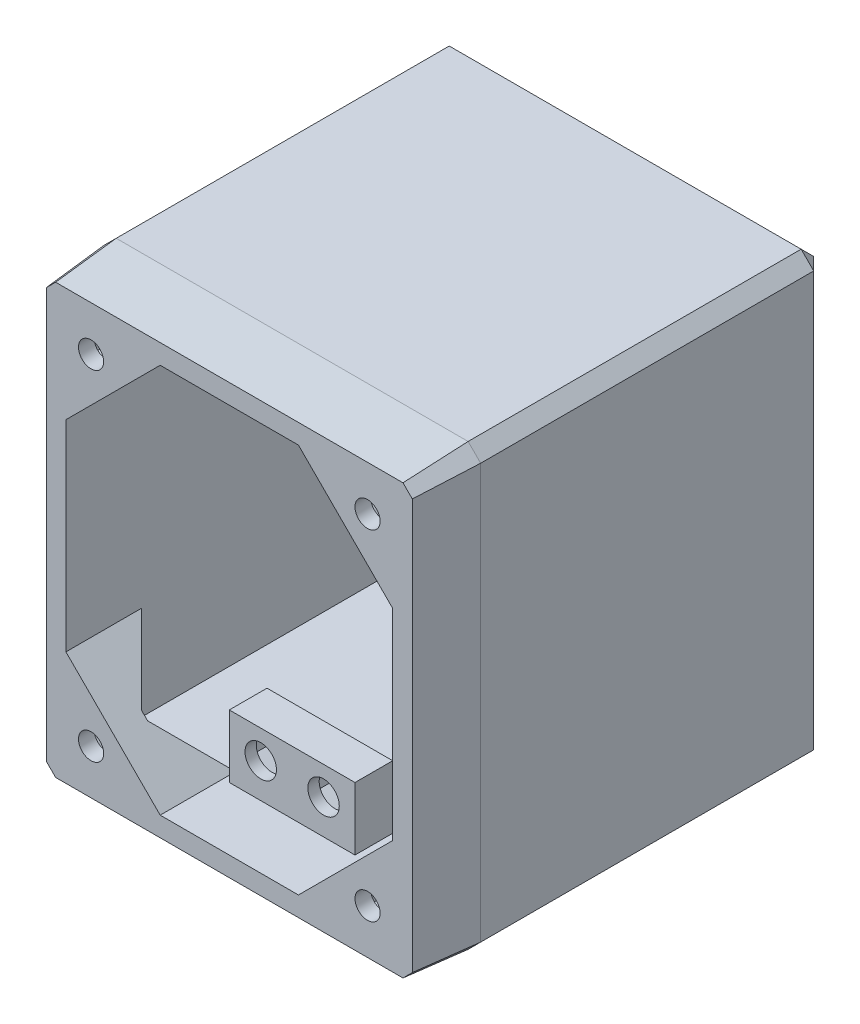
from build123d import *
from OCP.BRepFilletAPI import BRepFilletAPI_MakeChamfer

# Parameters (mm, degrees)
SKIZZE1_W                          = 60
SKIZZE1_H                          = 70
GRUNDK_RPER_DEPTH                  = 65
FASE2_SIZE                         = 2
WANDUNG1_T                         = -4
SKIZZE2_W                          = 20
SKIZZE2_H                          = 6
AUFSATZ_LINEAR_AUSTRAGEN1_DEPTH    = 10
BOHRUNGEN_SERVO_REACH              = 109.355
SKIZZE3_R                          = 2.5
SECHSKANT_START                    = -4.2
SKIZZE5_R                          = 2.5
SKIZZE5_R_2                        = 2
SECHSKANT_DEPTH                    = 4.2
AUSPARUNGEN_DEPTH                  = 5
FASE3_SIZE                         = 7
BOHRUNGENHALTERUNG_REACH           = 114.805
SKIZZE8_R                          = 2
SECHSKANT_START_2                  = -9.5
SECHSKANT_DECKEL_DEPTH             = 9.5
BOHRUNG_VERSCHRAUBUNG_DECKEL_REACH = 114.805
SKIZZE11_R                         = 3
SKIZZE14_R                         = 0.883929471
SKIZZE14_W                         = 12
SKIZZE14_H                         = 10
VERTIEFUNG_DECKEL_DEPTH            = 2
SKIZZE16_R                         = 6.25
AUFSATZ_KABELBOHRUNGEN_DEPTH       = 4
BOHRUNGSDURCHMESSER_KABEL_REACH    = 117.33
SKIZZE17_R                         = 4.5
FASE4_SIZE                         = 10
FASE4_SIZE2                        = 0.874886635


with BuildPart() as part:
    # Skizze1 → Grundkörper (new body)
    with BuildSketch(Plane.XY):
        with Locations((30, 35)):
            Rectangle(SKIZZE1_W, SKIZZE1_H)
    extrude(amount=GRUNDK_RPER_DEPTH)

    # Fase2
    fase2_edges = [part.edges().sort_by_distance(p)[0] for p in [
        (30, 70, 0),
        (60, 35, 0),
        (0, 35, 0),
        (0, 70, 32.5),
        (60, 70, 32.5),
        (60, 0, 32.5),
        (0, 0, 32.5),
    ]]
    chamfer(fase2_edges, length=FASE2_SIZE)

    # Wandung1
    wandung1_openings = [part.faces().sort_by_distance(p)[0] for p in [
        (30, 35, 65),
    ]]
    offset(amount=WANDUNG1_T, openings=wandung1_openings)

    # Skizze2 → Aufsatz-Linear austragen1 (add)
    with BuildSketch(Plane(origin=(0, 4, 0), x_dir=(1, 0, 0), z_dir=(0, 1, 0))):
        with Locations((30, -52)):
            Rectangle(SKIZZE2_W, SKIZZE2_H)
    aufsatz_linear_austragen1 = extrude(amount=AUFSATZ_LINEAR_AUSTRAGEN1_DEPTH)

    # Spiegeln1: Aufsatz-Linear austragen1 across plane
    add(aufsatz_linear_austragen1.mirror(Plane(origin=(0, 35, 0), x_dir=(0, 0, 1), z_dir=(0, -1, 0))))

    # Skizze3 → Bohrungen Servo (cut, up to next)
    with BuildSketch(Plane.XY.offset(55), mode=Mode.PRIVATE) as bohrungen_servo_sk1:
        with Locations((25, 9.5)):
            Circle(SKIZZE3_R)
    bohrungen_servo_tool1 = extrude(bohrungen_servo_sk1.sketch, amount=-BOHRUNGEN_SERVO_REACH, mode=Mode.PRIVATE) & part.part
    # Skizze3 → Bohrungen Servo (cut, up to next)
    with BuildSketch(Plane.XY.offset(55), mode=Mode.PRIVATE) as bohrungen_servo_sk2:
        with Locations((35, 9.5)):
            Circle(SKIZZE3_R)
    bohrungen_servo_tool2 = extrude(bohrungen_servo_sk2.sketch, amount=-BOHRUNGEN_SERVO_REACH, mode=Mode.PRIVATE) & part.part
    # Skizze3 → Bohrungen Servo (cut, up to next)
    with BuildSketch(Plane.XY.offset(55), mode=Mode.PRIVATE) as bohrungen_servo_sk3:
        with Locations((35, 60.5)):
            Circle(SKIZZE3_R)
    bohrungen_servo_tool3 = extrude(bohrungen_servo_sk3.sketch, amount=-BOHRUNGEN_SERVO_REACH, mode=Mode.PRIVATE) & part.part
    # Skizze3 → Bohrungen Servo (cut, up to next)
    with BuildSketch(Plane.XY.offset(55), mode=Mode.PRIVATE) as bohrungen_servo_sk4:
        with Locations((25, 60.5)):
            Circle(SKIZZE3_R)
    bohrungen_servo_tool4 = extrude(bohrungen_servo_sk4.sketch, amount=-BOHRUNGEN_SERVO_REACH, mode=Mode.PRIVATE) & part.part
    add(bohrungen_servo_tool1.solids().sort_by_distance((25, 9.5, 55))[0], mode=Mode.SUBTRACT)
    add(bohrungen_servo_tool2.solids().sort_by_distance((35, 9.5, 55))[0], mode=Mode.SUBTRACT)
    add(bohrungen_servo_tool3.solids().sort_by_distance((35, 60.5, 55))[0], mode=Mode.SUBTRACT)
    add(bohrungen_servo_tool4.solids().sort_by_distance((25, 60.5, 55))[0], mode=Mode.SUBTRACT)

    # Skizze5 → Sechskant (cut)
    # profile 1 of 4: a face of its own
    with BuildSketch(Plane(origin=(0, 0, 49), x_dir=(-1, 0, 0), z_dir=(0, 0, -1)).offset(SECHSKANT_START)):
        Polygon((-34.97509641, 13.541375155), (-38.487481756, 11.542254719), (-38.512385346, 7.500879564), (-35.02490359, 5.458624845), (-31.512518244, 7.457745281), (-31.487614654, 11.499120436), align=None)
        with Locations(Location((-35, 9.5, 0), (0, 0, 180))):
            Circle(SKIZZE5_R, mode=Mode.SUBTRACT)
    # profile 2 of 4: a face of its own
    with BuildSketch(Plane(origin=(0, 0, 49), x_dir=(-1, 0, 0), z_dir=(0, 0, -1)).offset(SECHSKANT_START)):
        Polygon((-31.487614654, 58.500879564), (-34.97509641, 56.458624845), (-38.487481756, 58.457745281), (-38.512385346, 62.499120436), (-35.02490359, 64.541375155), (-31.512518244, 62.542254719), align=None)
        with Locations(Location((-35, 60.5, 0), (0, 0, 180))):
            Circle(SKIZZE5_R, mode=Mode.SUBTRACT)
    # profile 3 of 4: a face of its own
    with BuildSketch(Plane(origin=(0, 0, 49), x_dir=(-1, 0, 0), z_dir=(0, 0, -1)).offset(SECHSKANT_START)):
        Polygon((-28.487481756, 62.542254719), (-28.512385346, 58.500879564), (-25.02490359, 56.458624845), (-21.512518244, 58.457745281), (-21.487614654, 62.499120436), (-24.97509641, 64.541375155), align=None)
        with Locations(Location((-25, 60.5, 0), (0, 0, 180))):
            Circle(SKIZZE5_R, mode=Mode.SUBTRACT)
    # profile 4 of 4: a face of its own
    with BuildSketch(Plane(origin=(0, 0, 49), x_dir=(-1, 0, 0), z_dir=(0, 0, -1)).offset(SECHSKANT_START)):
        Polygon((-28.512385346, 11.499120436), (-25.02490359, 13.541375155), (-21.512518244, 11.542254719), (-21.487614654, 7.500879564), (-24.97509641, 5.458624845), (-28.487481756, 7.457745281), align=None)
        with Locations((-25, 9.5)):
            Circle(SKIZZE5_R_2, mode=Mode.SUBTRACT)
    extrude(amount=SECHSKANT_DEPTH, mode=Mode.SUBTRACT)

    # Skizze7 → Ausparungen (add)
    with BuildSketch(Plane.XY.offset(65)):
        Polygon((56, 4), (41, 4), (56, 19), align=None)
        Polygon((19, 4), (4, 19), (4, 4), align=None)
        Polygon((4, 66), (19, 66), (4, 51), align=None)
        Polygon((41, 66), (56, 51), (56, 66), align=None)
    extrude(amount=-AUSPARUNGEN_DEPTH)

    # Fase3
    fase3_edges = [part.edges().sort_by_distance(p)[0] for p in [
        (56, 11.5, 60),
        (48.5, 4, 60),
        (11.5, 4, 60),
        (4, 11.5, 60),
        (4, 58.5, 60),
        (11.5, 66, 60),
        (48.5, 66, 60),
        (56, 58.5, 60),
    ]]
    chamfer(fase3_edges, length=FASE3_SIZE)

    # Skizze8 → BohrungenHalterung (cut, up to next)
    with BuildSketch(Plane.XY.offset(65), mode=Mode.PRIVATE) as bohrungenhalterung_sk1:
        with Locations((52, 8)):
            Circle(SKIZZE8_R)
    bohrungenhalterung_tool1 = extrude(bohrungenhalterung_sk1.sketch, amount=-BOHRUNGENHALTERUNG_REACH, mode=Mode.PRIVATE) & part.part
    # Skizze8 → BohrungenHalterung (cut, up to next)
    with BuildSketch(Plane.XY.offset(65), mode=Mode.PRIVATE) as bohrungenhalterung_sk2:
        with Locations(Location((8, 8, 0), (0, 0, 45))):
            Circle(SKIZZE8_R)
    bohrungenhalterung_tool2 = extrude(bohrungenhalterung_sk2.sketch, amount=-BOHRUNGENHALTERUNG_REACH, mode=Mode.PRIVATE) & part.part
    # Skizze8 → BohrungenHalterung (cut, up to next)
    with BuildSketch(Plane.XY.offset(65), mode=Mode.PRIVATE) as bohrungenhalterung_sk3:
        with Locations((8, 62)):
            Circle(SKIZZE8_R)
    bohrungenhalterung_tool3 = extrude(bohrungenhalterung_sk3.sketch, amount=-BOHRUNGENHALTERUNG_REACH, mode=Mode.PRIVATE) & part.part
    # Skizze8 → BohrungenHalterung (cut, up to next)
    with BuildSketch(Plane.XY.offset(65), mode=Mode.PRIVATE) as bohrungenhalterung_sk4:
        with Locations(Location((52, 62, 0), (0, 0, 45))):
            Circle(SKIZZE8_R)
    bohrungenhalterung_tool4 = extrude(bohrungenhalterung_sk4.sketch, amount=-BOHRUNGENHALTERUNG_REACH, mode=Mode.PRIVATE) & part.part
    add(bohrungenhalterung_tool1.solids().sort_by_distance((52, 8, 65))[0], mode=Mode.SUBTRACT)
    add(bohrungenhalterung_tool2.solids().sort_by_distance((8, 8, 65))[0], mode=Mode.SUBTRACT)
    add(bohrungenhalterung_tool3.solids().sort_by_distance((8, 62, 65))[0], mode=Mode.SUBTRACT)
    add(bohrungenhalterung_tool4.solids().sort_by_distance((52, 62, 65))[0], mode=Mode.SUBTRACT)

    # Skizze13 → Sechskant Deckel (cut)
    with BuildSketch(Plane.XY.offset(62.5).offset(SECHSKANT_START_2)):
        Polygon((50.909166509, 57.928953988), (54.98021252, 59.01978748), (56.071046012, 63.090833491), (53.090833491, 66.071046012), (49.01978748, 64.98021252), (47.928953988, 60.909166509), align=None)
        Polygon((49.01978748, 5.01978748), (53.090833491, 3.928953988), (56.071046012, 6.909166509), (54.98021252, 10.98021252), (50.909166509, 12.071046012), (47.928953988, 9.090833491), align=None)
        Polygon((3.928953988, 6.909166509), (6.909166509, 3.928953988), (10.98021252, 5.01978748), (12.071046012, 9.090833491), (9.090833491, 12.071046012), (5.01978748, 10.98021252), align=None)
        Polygon((5.01978748, 59.01978748), (9.090833491, 57.928953988), (12.071046012, 60.909166509), (10.98021252, 64.98021252), (6.909166509, 66.071046012), (3.928953988, 63.090833491), align=None)
    extrude(amount=SECHSKANT_DECKEL_DEPTH, mode=Mode.SUBTRACT)

    # Skizze11 → Bohrung Verschraubung Deckel (cut, up to next)
    with BuildSketch(Plane(origin=(0, 0, 0), x_dir=(-1, 0, 0), z_dir=(0, 0, -1)), mode=Mode.PRIVATE) as bohrung_verschraubung_deckel_sk1:
        with Locations((-30, 53)):
            Circle(SKIZZE11_R)
    bohrung_verschraubung_deckel_tool1 = extrude(bohrung_verschraubung_deckel_sk1.sketch, amount=-BOHRUNG_VERSCHRAUBUNG_DECKEL_REACH, mode=Mode.PRIVATE) & part.part
    add(bohrung_verschraubung_deckel_tool1.solids().sort_by_distance((30, 53, 0))[0], mode=Mode.SUBTRACT)

    # Skizze14 → Vertiefung Deckel (cut)
    with BuildSketch(Plane(origin=(0, 0, 0), x_dir=(-1, 0, 0), z_dir=(0, 0, -1))):
        with Locations((-30, 53)):
            Circle(SKIZZE14_R)
        with Locations((-30, 43)):
            Rectangle(SKIZZE14_W, SKIZZE14_H)
    extrude(amount=-VERTIEFUNG_DECKEL_DEPTH, mode=Mode.SUBTRACT)

    # Skizze16 → Aufsatz Kabelbohrungen (add)
    with BuildSketch(Plane.XZ):
        with Locations(Location((30, 20, 0), (0, 0, 90))):
            Circle(SKIZZE16_R)
    extrude(amount=AUFSATZ_KABELBOHRUNGEN_DEPTH)

    # Skizze17 → Bohrungsdurchmesser Kabel (cut, up to next)
    with BuildSketch(Plane.XZ.offset(4), mode=Mode.PRIVATE) as bohrungsdurchmesser_kabel_sk1:
        with Locations(Location((30, 20, 0), (0, 0, 270))):
            Circle(SKIZZE17_R)
    bohrungsdurchmesser_kabel_tool1 = extrude(bohrungsdurchmesser_kabel_sk1.sketch, amount=-BOHRUNGSDURCHMESSER_KABEL_REACH, mode=Mode.PRIVATE) & part.part
    add(bohrungsdurchmesser_kabel_tool1.solids().sort_by_distance((30, -4, 20))[0], mode=Mode.SUBTRACT)

    # Fase4: one chamfer whose edges measure the first distance from different faces: ONE call of the kernel's chamfer builder (chamfer() names one face for all edges)
    fase4_edges_1 = [part.edges().sort_by_distance(p)[0] for p in [
        (30, 0, 65),
    ]]
    fase4_side_1 = [part.faces().sort_by_distance(p)[0] for p in [
        (30, 0, 32.936126813),
    ]]
    fase4_edges_2 = [part.edges().sort_by_distance(p)[0] for p in [
        (0, 35, 65),
    ]]
    fase4_side_2 = [part.faces().sort_by_distance(p)[0] for p in [
        (0, 35, 33.5),
    ]]
    fase4_edges_3 = [part.edges().sort_by_distance(p)[0] for p in [
        (60, 35, 65),
    ]]
    fase4_side_3 = [part.faces().sort_by_distance(p)[0] for p in [
        (60, 35, 33.5),
    ]]
    fase4_edges_4 = [part.edges().sort_by_distance(p)[0] for p in [
        (30, 70, 65),
    ]]
    fase4_side_4 = [part.faces().sort_by_distance(p)[0] for p in [
        (30, 70, 33.5),
    ]]
    fase4_edges_5 = [part.edges().sort_by_distance(p)[0] for p in [
        (1, 69, 65),
    ]]
    fase4_side_5 = [part.faces().sort_by_distance(p)[0] for p in [
        (1, 69, 33.5),
    ]]
    fase4_edges_6 = [part.edges().sort_by_distance(p)[0] for p in [
        (59, 69, 65),
    ]]
    fase4_side_6 = [part.faces().sort_by_distance(p)[0] for p in [
        (59, 69, 33.5),
    ]]
    fase4_edges_7 = [part.edges().sort_by_distance(p)[0] for p in [
        (59, 1, 65),
    ]]
    fase4_side_7 = [part.faces().sort_by_distance(p)[0] for p in [
        (58.994791667, 0.994791667, 32.997395833),
    ]]
    fase4_edges_8 = [part.edges().sort_by_distance(p)[0] for p in [
        (1, 1, 65),
    ]]
    fase4_side_8 = [part.faces().sort_by_distance(p)[0] for p in [
        (1.005208333, 0.994791667, 32.997395833),
    ]]
    fase4 = BRepFilletAPI_MakeChamfer(part.part.solid().wrapped)
    for e in fase4_edges_1:
        fase4.Add(FASE4_SIZE, FASE4_SIZE2, e.wrapped, fase4_side_1[0].wrapped)  # the first distance lies on this face
    for e in fase4_edges_2:
        fase4.Add(FASE4_SIZE, FASE4_SIZE2, e.wrapped, fase4_side_2[0].wrapped)  # the first distance lies on this face
    for e in fase4_edges_3:
        fase4.Add(FASE4_SIZE, FASE4_SIZE2, e.wrapped, fase4_side_3[0].wrapped)  # the first distance lies on this face
    for e in fase4_edges_4:
        fase4.Add(FASE4_SIZE, FASE4_SIZE2, e.wrapped, fase4_side_4[0].wrapped)  # the first distance lies on this face
    for e in fase4_edges_5:
        fase4.Add(FASE4_SIZE, FASE4_SIZE2, e.wrapped, fase4_side_5[0].wrapped)  # the first distance lies on this face
    for e in fase4_edges_6:
        fase4.Add(FASE4_SIZE, FASE4_SIZE2, e.wrapped, fase4_side_6[0].wrapped)  # the first distance lies on this face
    for e in fase4_edges_7:
        fase4.Add(FASE4_SIZE, FASE4_SIZE2, e.wrapped, fase4_side_7[0].wrapped)  # the first distance lies on this face
    for e in fase4_edges_8:
        fase4.Add(FASE4_SIZE, FASE4_SIZE2, e.wrapped, fase4_side_8[0].wrapped)  # the first distance lies on this face
    add(Compound.cast(fase4.Shape()), mode=Mode.REPLACE)


solid = part.part
